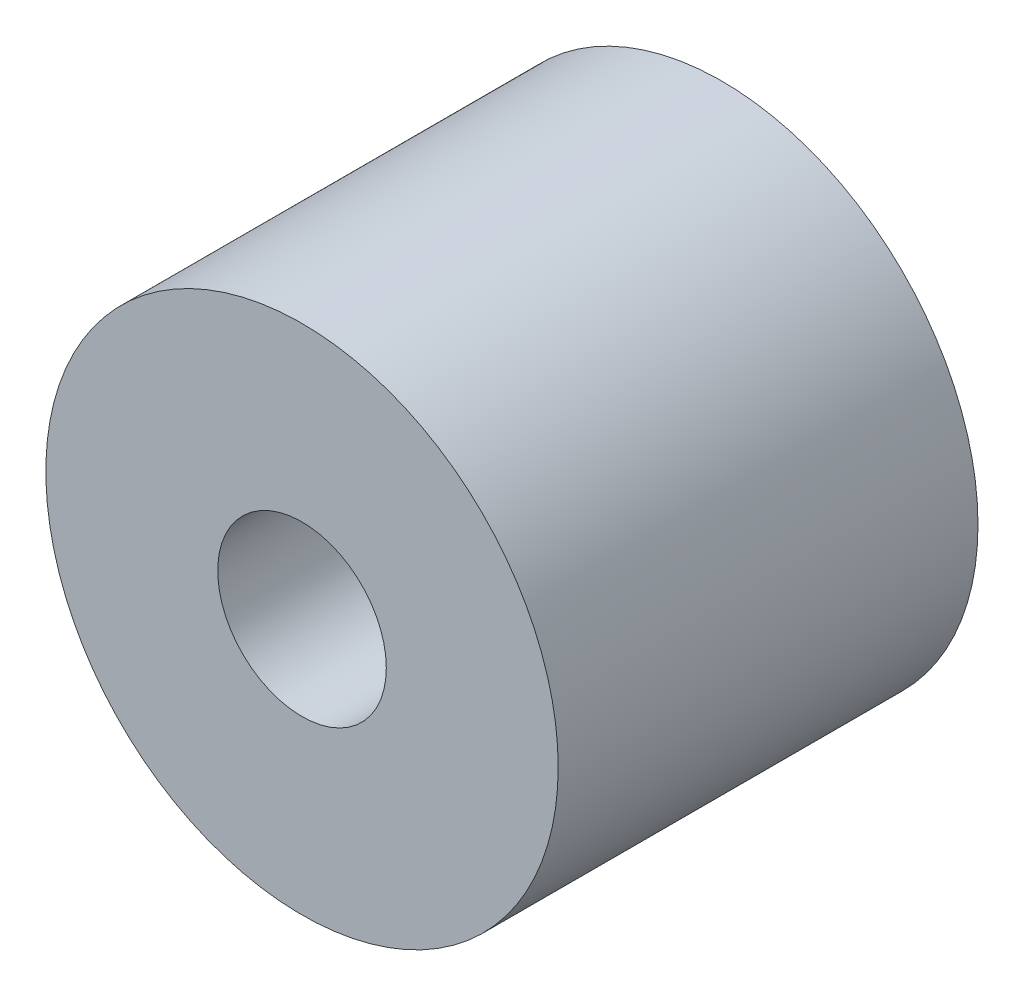
from build123d import *

# Parameters (mm, degrees)
SKETCH1_R           = 7.75
SKETCH1_R_2         = 2.55
BOSS_EXTRUDE1_DEPTH = 6.35


with BuildPart() as part:
    # Sketch1 → Boss-Extrude1 (new, symmetric)
    with BuildSketch(Plane.XY):
        Circle(SKETCH1_R)
        Circle(SKETCH1_R_2, mode=Mode.SUBTRACT)
    extrude(amount=BOSS_EXTRUDE1_DEPTH, both=True)


solid = part.part
